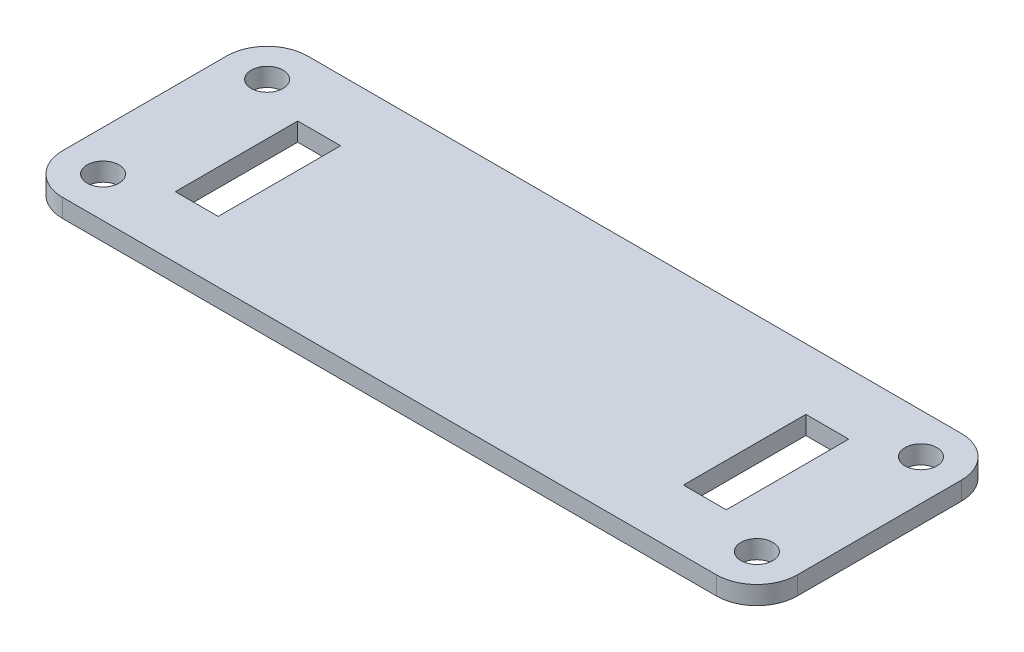
from build123d import *

# Parameters (mm, degrees)
SKETCH1_R           = 2.6
BOSS_EXTRUDE1_DEPTH = 1.5
SKETCH2_W           = 7
SKETCH2_H           = 20
CUT_EXTRUDE1_DEPTH  = 64.316664473


with BuildPart() as part:
    # Sketch1 → Boss-Extrude1 (new, symmetric)
    with BuildSketch(Plane(origin=(0, 0, 0), x_dir=(1, 0, 0), z_dir=(0, 1, 0))):
        with BuildLine():
            Line((-53.4, -20), (53.4, -20))
            ThreePointArc((53.4, -20), (58.066904756, -18.066904756), (60, -13.4))
            Line((60, -13.4), (60, 13.4))
            ThreePointArc((60, 13.4), (58.066904756, 18.066904756), (53.4, 20))
            Line((53.4, 20), (-53.4, 20))
            ThreePointArc((-53.4, 20), (-58.066904756, 18.066904756), (-60, 13.4))
            Line((-60, 13.4), (-60, -13.4))
            ThreePointArc((-60, -13.4), (-58.066904756, -18.066904756), (-53.4, -20))
        make_face()
        with Locations(Location((-53.4, 13.4, 0), (0, 0, 270))):
            Circle(SKETCH1_R, mode=Mode.SUBTRACT)
        with Locations(Location((53.4, 13.4, 0), (0, 0, 90))):
            Circle(SKETCH1_R, mode=Mode.SUBTRACT)
        with Locations(Location((53.4, -13.4, 0), (0, 0, 270))):
            Circle(SKETCH1_R, mode=Mode.SUBTRACT)
        with Locations(Location((-53.4, -13.4, 0), (0, 0, 90))):
            Circle(SKETCH1_R, mode=Mode.SUBTRACT)
    extrude(amount=BOSS_EXTRUDE1_DEPTH, both=True)

    # Sketch2 → Cut-Extrude1 (cut, through all)
    with BuildSketch(Plane(origin=(0, 1.5, 0), x_dir=(1, 0, 0), z_dir=(0, 1, 0))):
        with Locations((-41.5, 0)):
            Rectangle(SKETCH2_W, SKETCH2_H)
        with Locations((41.5, 0)):
            Rectangle(SKETCH2_W, SKETCH2_H)
    extrude(amount=-CUT_EXTRUDE1_DEPTH, mode=Mode.SUBTRACT)


solid = part.part
